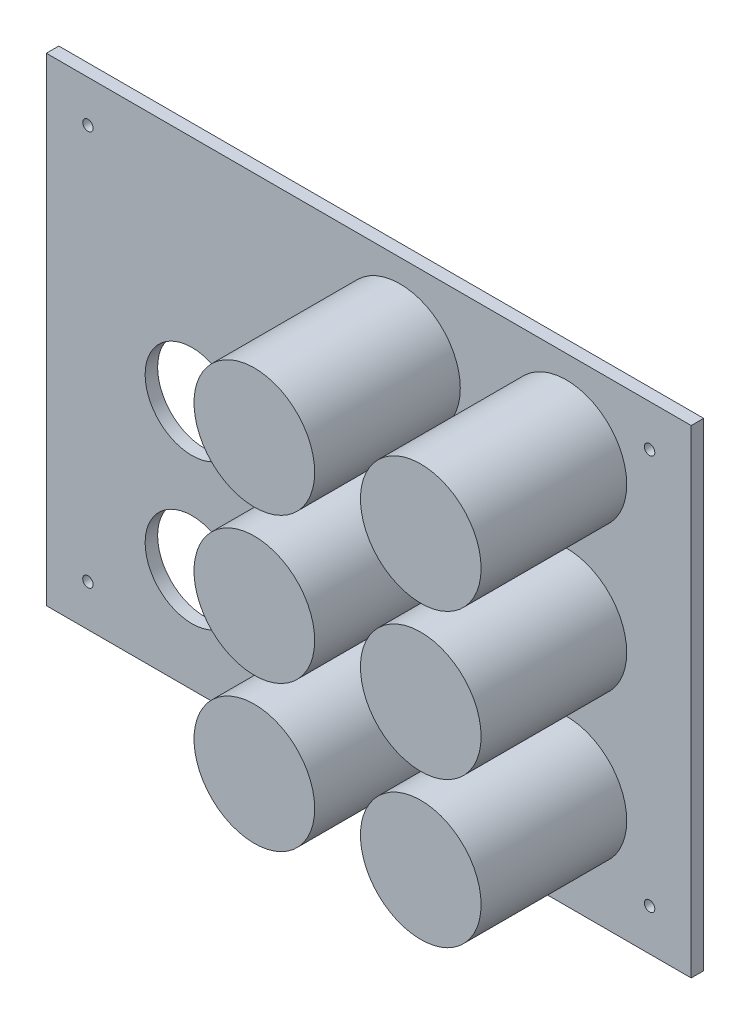
from build123d import *

# Parameters (mm, degrees)
ESBO_O1_W                                    = 155
ESBO_O1_H                                    = 115
RESSALTO_EXTRUS_O1_DEPTH                     = 3
ESBO_O12_R                                   = 14.5
RESSALTO_EXTRUS_O14_DEPTH                    = 35
RESSALTO_EXTRUS_O14_2_DEPTH                  = 35
RESSALTO_EXTRUS_O14_3_DEPTH                  = 35
RESSALTO_EXTRUS_O14_4_DEPTH                  = 35
RESSALTO_EXTRUS_O14_5_DEPTH                  = 35
RESSALTO_EXTRUS_O14_6_DEPTH                  = 35
ESBO_O11_R                                   = 12.5
CORTE_EXTRUS_O8_DEPTH                        = 35
ESBO_O11_5_R                                 = 12.5
CORTE_EXTRUS_O9_DEPTH                        = 35
REBAIXO_PARA_PARAFUSO_DE_M_QUINA_COM_2_COUNT = 2
REBAIXO_PARA_PARAFUSO_DE_M_QUINA_COM_2_PITCH = 95
REBAIXO_PARA_PARAFUSO_DE_M_QUINA_COM_3_COUNT = 2
REBAIXO_PARA_PARAFUSO_DE_M_QUINA_COM_3_PITCH = 165.075740192
REBAIXO_PARA_PARAFUSO_DE_M_QUINA_COM_4_COUNT = 2
REBAIXO_PARA_PARAFUSO_DE_M_QUINA_COM_4_PITCH = 135
ESBO_O13_R                                   = 11.25
BOT_ES_DEPTH                                 = 3
ESBO_O29_R                                   = 1
PINO_1_DEPTH                                 = 1.5
ESBO_O28_R                                   = 1
PINO_2_DEPTH                                 = 1.5
SKETCH_3_R                                   = 1
PINO_3_DEPTH                                 = 1.5
SKETCH_4_R                                   = 1
PINO_4_DEPTH                                 = 1.5
SKETCH_5_R                                   = 1
PINO_5_DEPTH                                 = 1.5
SKETCH_6_R                                   = 1
PINO_6_DEPTH                                 = 1.5


with BuildPart() as part:
    # Esboço1 → Ressalto-extrusão1 (new body)
    with BuildSketch(Plane.XY):
        Rectangle(ESBO_O1_W, ESBO_O1_H)
    extrude(amount=RESSALTO_EXTRUS_O1_DEPTH)


with BuildPart() as body_2:
    # Esboço12 → Ressalto-extrusão14 (new body)
    with BuildSketch(Plane.XY.offset(3)):
        with Locations((7.5, 37.5)):
            Circle(ESBO_O12_R)
    extrude(amount=RESSALTO_EXTRUS_O14_DEPTH)


with BuildPart() as body_3:
    # Esboço12 → Ressalto-extrus_o14 2 (new body)
    with BuildSketch(Plane.XY.offset(3)):
        with Locations((47.5, 37.5)):
            Circle(ESBO_O12_R)
    extrude(amount=RESSALTO_EXTRUS_O14_2_DEPTH)


with BuildPart() as body_4:
    # Esboço12 → Ressalto-extrus_o14 3 (new body)
    with BuildSketch(Plane.XY.offset(3)):
        with Locations((7.5, 2.5)):
            Circle(ESBO_O12_R)
    extrude(amount=RESSALTO_EXTRUS_O14_3_DEPTH)


with BuildPart() as body_5:
    # Esboço12 → Ressalto-extrus_o14 4 (new body)
    with BuildSketch(Plane.XY.offset(3)):
        with Locations((47.5, 2.5)):
            Circle(ESBO_O12_R)
    extrude(amount=RESSALTO_EXTRUS_O14_4_DEPTH)


with BuildPart() as body_6:
    # Esboço12 → Ressalto-extrus_o14 5 (new body)
    with BuildSketch(Plane.XY.offset(3)):
        with Locations((47.5, -32.5)):
            Circle(ESBO_O12_R)
    extrude(amount=RESSALTO_EXTRUS_O14_5_DEPTH)


with BuildPart() as body_7:
    # Esboço12 → Ressalto-extrus_o14 6 (new body)
    with BuildSketch(Plane.XY.offset(3)):
        with Locations((7.5, -32.5)):
            Circle(ESBO_O12_R)
    extrude(amount=RESSALTO_EXTRUS_O14_6_DEPTH)


with BuildPart() as corte_extrus_o8_tool:
    # Esboço11 → Corte-extrusão8 (new body)
    with BuildSketch(Plane(origin=(0, 0, 0), x_dir=(-1, 0, 0), z_dir=(0, 0, -1))):
        with Locations((-47.5, 37.5)):
            Circle(ESBO_O11_R)
    extrude(amount=-CORTE_EXTRUS_O8_DEPTH)


with BuildPart() as part_1:
    add(part.part)

    # Corte-extrusão8: cut by corte_extrus_o8_tool
    add(corte_extrus_o8_tool.part, mode=Mode.SUBTRACT)


with BuildPart() as body_3_1:
    add(body_3.part)

    # Corte-extrusão8: cut by corte_extrus_o8_tool
    add(corte_extrus_o8_tool.part, mode=Mode.SUBTRACT)


with BuildPart() as corte_extrus_o9_tool:
    # Esboço11<5> → Corte-extrusão9 (new body)
    with BuildSketch(Plane(origin=(0, 0, 0), x_dir=(-1, 0, 0), z_dir=(0, 0, -1))):
        with Locations((-7.5, -32.5)):
            Circle(ESBO_O11_5_R)
        with Locations((-47.5, -32.5)):
            Circle(ESBO_O11_5_R)
        with Locations((-47.5, 2.5)):
            Circle(ESBO_O11_5_R)
        with Locations((-7.5, 37.5)):
            Circle(ESBO_O11_5_R)
        with Locations((-7.5, 2.5)):
            Circle(ESBO_O11_5_R)
    extrude(amount=-CORTE_EXTRUS_O9_DEPTH)


with BuildPart() as part_2:
    add(part_1.part)

    # Corte-extrusão9: cut by corte_extrus_o9_tool
    add(corte_extrus_o9_tool.part, mode=Mode.SUBTRACT)

    # Esboço15 → Rebaixo para parafuso de máquina com cabeça panela de #01 (revolve, cut)
    with BuildSketch(Plane(origin=(-67.5, -47.5, 0), x_dir=(0, 1, 0), z_dir=(1, 0, 0))):
        Polygon((0, 0), (0, 38), (1.25, 38), (1.25, 1.1176), (1.78562, 1.1176), (1.78562, 0.821800183), (2.5, 0), align=None)
    rebaixo_para_parafuso_de_m_quina_com_cab = revolve(axis=Axis((-67.5, -47.5, -6.35), (0, 0, 1)), mode=Mode.SUBTRACT)

    # Rebaixo para parafuso de m_quina com 2: Rebaixo para parafuso de máquina com cabeça panela de #01 ×2
    with Locations(*[(0, i * REBAIXO_PARA_PARAFUSO_DE_M_QUINA_COM_2_PITCH, 0) for i in range(1, REBAIXO_PARA_PARAFUSO_DE_M_QUINA_COM_2_COUNT)]):
        add(rebaixo_para_parafuso_de_m_quina_com_cab, mode=Mode.SUBTRACT)

    # Rebaixo para parafuso de m_quina com 3: Rebaixo para parafuso de máquina com cabeça panela de #01 ×2
    with Locations(*[Vector(0.8178064193007666, 0.5754934061746136, 0) * (i * REBAIXO_PARA_PARAFUSO_DE_M_QUINA_COM_3_PITCH) for i in range(1, REBAIXO_PARA_PARAFUSO_DE_M_QUINA_COM_3_COUNT)]):
        add(rebaixo_para_parafuso_de_m_quina_com_cab, mode=Mode.SUBTRACT)

    # Rebaixo para parafuso de m_quina com 4: Rebaixo para parafuso de máquina com cabeça panela de #01 ×2
    with Locations(*[(i * REBAIXO_PARA_PARAFUSO_DE_M_QUINA_COM_4_PITCH, 0, 0) for i in range(1, REBAIXO_PARA_PARAFUSO_DE_M_QUINA_COM_4_COUNT)]):
        add(rebaixo_para_parafuso_de_m_quina_com_cab, mode=Mode.SUBTRACT)

    # Esboço13 → Botões (cut)
    with BuildSketch(Plane(origin=(0, 0, 0), x_dir=(-1, 0, 0), z_dir=(0, 0, -1))):
        with Locations((42.5, -32.5)):
            Circle(ESBO_O13_R)
        with Locations((42.5, 2.5)):
            Circle(ESBO_O13_R)
    extrude(amount=-BOT_ES_DEPTH, mode=Mode.SUBTRACT)

    # Esboço29 → Pino 1 (add)
    with BuildSketch(Plane(origin=(0, 0, 0), x_dir=(-1, 0, 0), z_dir=(0, 0, -1))):
        with Locations(Location((12.5, -35.5, 0), (0, 0, 180))):
            Circle(ESBO_O29_R)
        with Locations(Location((12.5, -32.5, 0), (0, 0, 180))):
            Circle(ESBO_O29_R)
        with Locations(Location((12.5, -29.5, 0), (0, 0, 180))):
            Circle(ESBO_O29_R)
        with Locations(Location((15.5, -29.5, 0), (0, 0, 180))):
            Circle(ESBO_O29_R)
        with Locations(Location((9.5, -35.5, 0), (0, 0, 180))):
            Circle(ESBO_O29_R)
    extrude(amount=PINO_1_DEPTH)

    # Esboço28 → Pino 2 (add)
    with BuildSketch(Plane(origin=(0, 0, 0), x_dir=(-1, 0, 0), z_dir=(0, 0, -1))):
        with Locations(Location((12.5, -0.5, 0), (0, 0, 180))):
            Circle(ESBO_O28_R)
        with Locations(Location((12.5, 2.5, 0), (0, 0, 180))):
            Circle(ESBO_O28_R)
        with Locations(Location((12.5, 5.5, 0), (0, 0, 180))):
            Circle(ESBO_O28_R)
        with Locations(Location((15.5, 5.5, 0), (0, 0, 180))):
            Circle(ESBO_O28_R)
        with Locations(Location((9.5, 2.5, 0), (0, 0, 180))):
            Circle(ESBO_O28_R)
        with Locations(Location((9.5, -0.5, 0), (0, 0, 180))):
            Circle(ESBO_O28_R)
    extrude(amount=PINO_2_DEPTH)

    # 3 → Pino 3 (add)
    with BuildSketch(Plane(origin=(0, 0, 0), x_dir=(-1, 0, 0), z_dir=(0, 0, -1))):
        with Locations(Location((12.5, 34.5, 0), (0, 0, 180))):
            Circle(SKETCH_3_R)
        with Locations(Location((12.5, 37.5, 0), (0, 0, 180))):
            Circle(SKETCH_3_R)
        with Locations(Location((12.5, 40.5, 0), (0, 0, 180))):
            Circle(SKETCH_3_R)
        with Locations(Location((15.5, 40.5, 0), (0, 0, 180))):
            Circle(SKETCH_3_R)
        with Locations(Location((7, 34.5, 0), (0, 0, 180))):
            Circle(SKETCH_3_R)
        with Locations(Location((9.5, 34.5, 0), (0, 0, 180))):
            Circle(SKETCH_3_R)
    extrude(amount=PINO_3_DEPTH)

    # 4 → Pino 4 (add)
    with BuildSketch(Plane(origin=(0, 0, 0), x_dir=(-1, 0, 0), z_dir=(0, 0, -1))):
        with Locations(Location((-27.5, -35.5, 0), (0, 0, 180))):
            Circle(SKETCH_4_R)
        with Locations(Location((-27.5, -32.5, 0), (0, 0, 180))):
            Circle(SKETCH_4_R)
        with Locations(Location((-27.5, -29.5, 0), (0, 0, 180))):
            Circle(SKETCH_4_R)
        with Locations(Location((-24.5, -29.5, 0), (0, 0, 180))):
            Circle(SKETCH_4_R)
        with Locations(Location((-33, -35.5, 0), (0, 0, 180))):
            Circle(SKETCH_4_R)
        with Locations(Location((-30.5, -35.5, 0), (0, 0, 180))):
            Circle(SKETCH_4_R)
        with Locations(Location((-33, -32.5, 0), (0, 0, 180))):
            Circle(SKETCH_4_R)
    extrude(amount=PINO_4_DEPTH)

    # 5 → Pino 5 (add)
    with BuildSketch(Plane(origin=(0, 0, 0), x_dir=(-1, 0, 0), z_dir=(0, 0, -1))):
        with Locations(Location((-27.5, -0.5, 0), (0, 0, 180))):
            Circle(SKETCH_5_R)
        with Locations(Location((-27.5, 2.5, 0), (0, 0, 180))):
            Circle(SKETCH_5_R)
        with Locations(Location((-27.5, 5.5, 0), (0, 0, 180))):
            Circle(SKETCH_5_R)
        with Locations(Location((-24.5, 5.5, 0), (0, 0, 180))):
            Circle(SKETCH_5_R)
        with Locations(Location((-30.5, -0.5, 0), (0, 0, 180))):
            Circle(SKETCH_5_R)
        with Locations(Location((-33, 2.5, 0), (0, 0, 180))):
            Circle(SKETCH_5_R)
    extrude(amount=PINO_5_DEPTH)

    # 6 → Pino 6 (add)
    with BuildSketch(Plane(origin=(0, 0, 0), x_dir=(-1, 0, 0), z_dir=(0, 0, -1))):
        with Locations(Location((-27.5, 34.5, 0), (0, 0, 180))):
            Circle(SKETCH_6_R)
        with Locations(Location((-27.5, 37.5, 0), (0, 0, 180))):
            Circle(SKETCH_6_R)
        with Locations(Location((-27.5, 40.5, 0), (0, 0, 180))):
            Circle(SKETCH_6_R)
        with Locations(Location((-24.5, 40.5, 0), (0, 0, 180))):
            Circle(SKETCH_6_R)
        with Locations(Location((-33, 34.5, 0), (0, 0, 180))):
            Circle(SKETCH_6_R)
        with Locations(Location((-30.5, 34.5, 0), (0, 0, 180))):
            Circle(SKETCH_6_R)
        with Locations(Location((-30.5, 37.5, 0), (0, 0, 180))):
            Circle(SKETCH_6_R)
    extrude(amount=PINO_6_DEPTH)


with BuildPart() as body_2_1:
    add(body_2.part)

    # Corte-extrusão9: cut by corte_extrus_o9_tool
    add(corte_extrus_o9_tool.part, mode=Mode.SUBTRACT)


with BuildPart() as body_4_1:
    add(body_4.part)

    # Corte-extrusão9: cut by corte_extrus_o9_tool
    add(corte_extrus_o9_tool.part, mode=Mode.SUBTRACT)


with BuildPart() as body_5_1:
    add(body_5.part)

    # Corte-extrusão9: cut by corte_extrus_o9_tool
    add(corte_extrus_o9_tool.part, mode=Mode.SUBTRACT)


with BuildPart() as body_6_1:
    add(body_6.part)

    # Corte-extrusão9: cut by corte_extrus_o9_tool
    add(corte_extrus_o9_tool.part, mode=Mode.SUBTRACT)


with BuildPart() as body_7_1:
    add(body_7.part)

    # Corte-extrusão9: cut by corte_extrus_o9_tool
    add(corte_extrus_o9_tool.part, mode=Mode.SUBTRACT)


solid = Compound([body_3_1.part, part_2.part, body_2_1.part, body_4_1.part, body_5_1.part, body_6_1.part, body_7_1.part])
